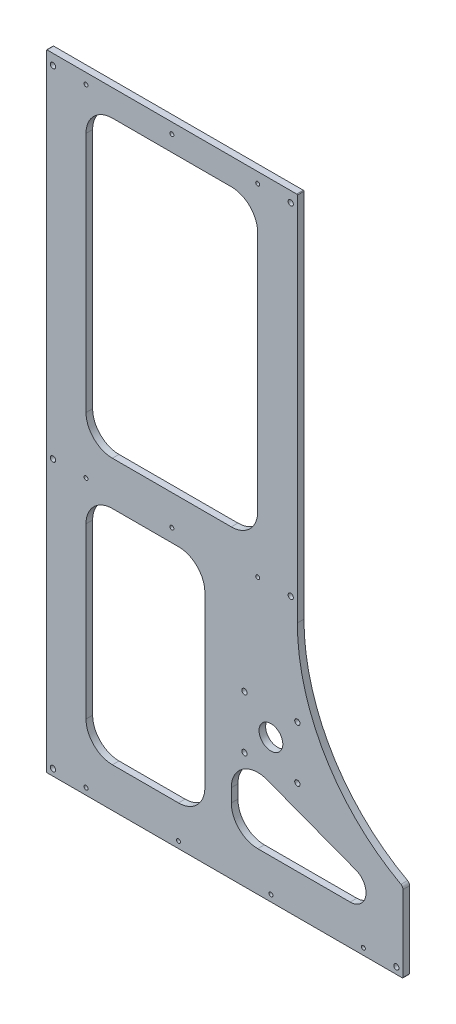
from build123d import *

# Parameters (mm, degrees)
SKETCH1_R          = 9
EXTRUDE1_DEPTH     = 5
SKETCH2_R          = 2
SKETCH2_R_2        = 1.5
CUT_EXTRUDE1_DEPTH = 546.528184423
FILLET1_R          = 3
FILLET2_R          = 0.5
SKETCH3_R          = 2
CUT_EXTRUDE2_DEPTH = 546.528184423


with BuildPart() as part:
    # Sketch1 → Extrude1 (new body)
    with BuildSketch(Plane.XY):
        with BuildLine():
            Line((0, 0), (0, 474))
            Line((0, 474), (190, 474))
            Line((190, 474), (190, 193))
            ThreePointArc((190, 193), (211.541001234, 115.396842848), (270, 60))
            Line((270, 60), (270, 0))
            Line((270, 0), (0, 0))
        make_face()
        with Locations((170, 108)):
            Circle(SKETCH1_R, mode=Mode.SUBTRACT)
        with BuildLine():
            Line((30, 434), (30, 251))
            ThreePointArc((30, 251), (35.857864376, 236.857864376), (50, 231))
            Line((50, 231), (140, 231))
            ThreePointArc((140, 231), (154.142135624, 236.857864376), (160, 251))
            Line((160, 251), (160, 434))
            ThreePointArc((160, 434), (154.142135624, 448.142135624), (140, 454))
            Line((140, 454), (50, 454))
            ThreePointArc((50, 454), (35.857864376, 448.142135624), (30, 434))
        make_face(mode=Mode.SUBTRACT)
        with BuildLine():
            Line((30, 178), (30, 50))
            ThreePointArc((30, 50), (35.857864376, 35.857864376), (50, 30))
            Line((50, 30), (100, 30))
            ThreePointArc((100, 30), (114.142135624, 35.857864376), (120, 50))
            Line((120, 50), (120, 178))
            ThreePointArc((120, 178), (114.142135624, 192.142135624), (100, 198))
            Line((100, 198), (50, 198))
            ThreePointArc((50, 198), (35.857864376, 192.142135624), (30, 178))
        make_face(mode=Mode.SUBTRACT)
        with BuildLine():
            Line((160, 30), (230, 30))
            ThreePointArc((230, 30), (241.803319166, 39.836286369), (234.256500428, 53.219723887))
            Line((234.256500428, 53.219723887), (167.09416738, 78.699539812))
            ThreePointArc((167.09416738, 78.699539812), (148.639615931, 76.460306006), (140, 60))
            Line((140, 60), (140, 50))
            ThreePointArc((140, 50), (145.857864376, 35.857864376), (160, 30))
        make_face(mode=Mode.SUBTRACT)
    extrude(amount=EXTRUDE1_DEPTH)

    # Sketch2 → Cut-Extrude1 (cut, through all)
    with BuildSketch(Plane.XY.offset(5)):
        with Locations((185, 466)):
            Circle(SKETCH2_R)
        with Locations((5, 466)):
            Circle(SKETCH2_R)
        with Locations((5, 208)):
            Circle(SKETCH2_R)
        with Locations((5, 5)):
            Circle(SKETCH2_R)
        with Locations((265, 5)):
            Circle(SKETCH2_R)
        with Locations((185, 208)):
            Circle(SKETCH2_R)
        with Locations((30, 5)):
            Circle(SKETCH2_R_2)
        with Locations((100, 5)):
            Circle(SKETCH2_R_2)
        with Locations((170, 5)):
            Circle(SKETCH2_R_2)
        with Locations((240, 5)):
            Circle(SKETCH2_R_2)
        with Locations((30, 208)):
            Circle(SKETCH2_R_2)
        with Locations((95, 208)):
            Circle(SKETCH2_R_2)
        with Locations((160, 208)):
            Circle(SKETCH2_R_2)
        with Locations((30, 466)):
            Circle(SKETCH2_R_2)
        with Locations((95, 466)):
            Circle(SKETCH2_R_2)
        with Locations((160, 466)):
            Circle(SKETCH2_R_2)
    extrude(amount=-CUT_EXTRUDE1_DEPTH, mode=Mode.SUBTRACT)

    # Fillet1
    fillet1_edges = [part.edges().sort_by_distance(p)[0] for p in [
        (270, 60, 2.5),
    ]]
    fillet(fillet1_edges, radius=FILLET1_R)

    # Fillet2
    fillet2_edges = [part.edges().sort_by_distance(p)[0] for p in [
        (190, 474, 2.5),
        (270, 0, 2.5),
        (0, 0, 2.5),
        (0, 474, 2.5),
    ]]
    fillet(fillet2_edges, radius=FILLET2_R)

    # Sketch3 → Cut-Extrude2 (cut, through all)
    with BuildSketch(Plane.XY.offset(5)):
        with Locations((150, 128)):
            Circle(SKETCH3_R)
        with Locations((190, 128)):
            Circle(SKETCH3_R)
        with Locations((150, 88)):
            Circle(SKETCH3_R)
        with Locations((190, 88)):
            Circle(SKETCH3_R)
    extrude(amount=-CUT_EXTRUDE2_DEPTH, mode=Mode.SUBTRACT)


solid = part.part
